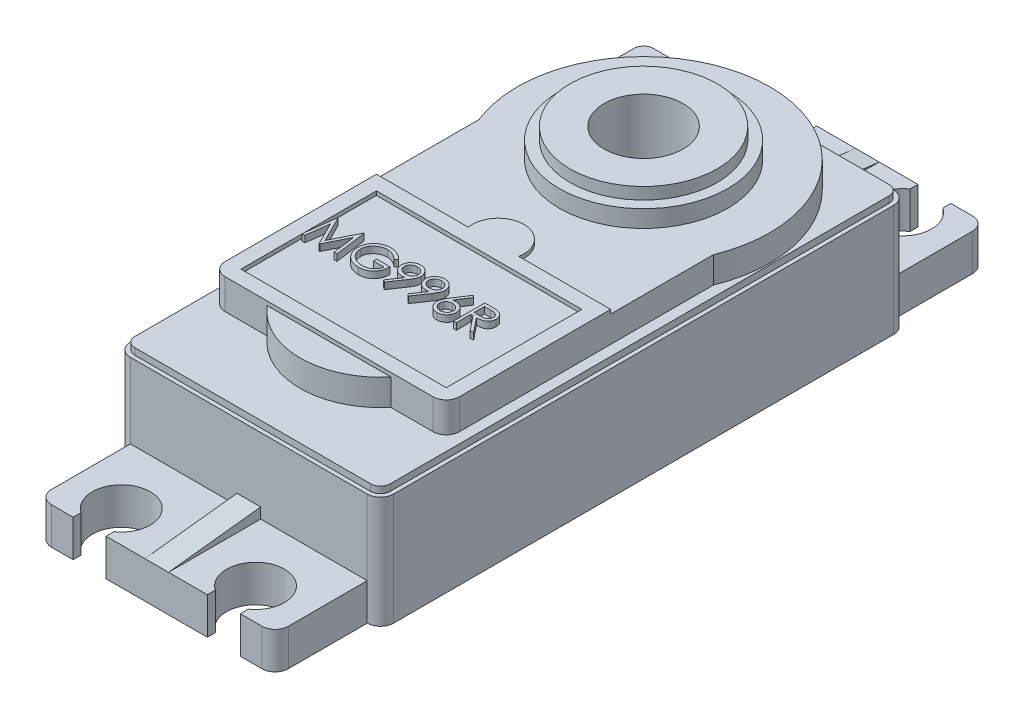
from build123d import *

# Parameters (mm, degrees)
BASES_W                              = 20
BASES_H                              = 40
BASE_DEPTH                           = 9
SHAFTHOLES_R                         = 3
SHAFT_HOLE_DEPTH                     = 25.103941586
MOUNTINGTABS_W                       = 18
MOUNTINGTABS_H                       = 2.8
MOUNTING_TAB_DEPTH                   = 7
MOUNTING_HOLE_DEPTH                  = 30.452334373
BOTTOMALIGNHOLES_R                   = 0.7
BOTTOM_ALIGN_HOLE_DEPTH              = 0.5
TRIANGULAR_TAB_DEPTH                 = 0.9
MOUNTING_TAB_FEATURES_M_COPY_1_DEPTH = 30.452334373
BASE_START                           = 2
BASETOPBODYS_R                       = 3
BASE_TOP_BODY_DEPTH                  = 2
PART_CIRCLE_DEPTH                    = 2
TOP_START                            = 1.3
TOPBODYCYLINDER1_R                   = 6.4
TOPBODYCYLINDER1_R_2                 = 3
TOP_BODY_CYLINDER_1_DEPTH            = 1.3
TOB_START                            = 0.9
TOPBODYCYLINDER2_R                   = 5.6
TOPBODYCYLINDER2_R_2                 = 3
TOB_BODY_CYLINDER_2_DEPTH            = 0.9
TOPBODYLABELNEST_W                   = 17.8
TOPBODYLABELNEST_H                   = 12.5
TOPBODYLABELNEST_W_2                 = 15.6
TOPBODYLABELNEST_H_2                 = 10.3
TOP_BODY_LABEL_NEST_DEPTH            = 0.3
PART_CIRCLE_2_DEPTH                  = 0.3
BORDERCUTS_W                         = 20
BORDERCUTS_H                         = 40
BORDERCUTS_W_2                       = 19.4
BORDERCUTS_H_2                       = 39.4
BORDER_CUT_DEPTH                     = 0.5
MAIN_BODY_FEATURES_F_R               = 1
BORDER_CUT_F_R                       = 0.75
BOSS_EXTRU_1_DEPTH                   = 0.5


with BuildPart() as part:
    # BaseS → BASE (new body)
    with BuildSketch(Plane(origin=(0, 0, 0), x_dir=(1, 0, 0), z_dir=(0, 1, 0))):
        Rectangle(BASES_W, BASES_H)
    extrude(amount=BASE_DEPTH)

    # ShaftHoleS → SHAFT HOLE (cut, through all)
    with BuildSketch(Plane(origin=(0, 9, 0), x_dir=(1, 0, 0), z_dir=(0, 1, 0))):
        with Locations(Location((0, 10, 0), (0, 0, 270))):
            Circle(SHAFTHOLES_R)
    extrude(amount=-SHAFT_HOLE_DEPTH, mode=Mode.SUBTRACT)

    # MountingTabS → MOUNTING TAB (add)
    with BuildSketch(Plane.XY.offset(20)):
        with Locations((0, 1.4)):
            Rectangle(MOUNTINGTABS_W, MOUNTINGTABS_H)
    mounting_tab = extrude(amount=MOUNTING_TAB_DEPTH)

    # MountingHoleS → MOUNTING HOLE (cut, through all)
    with BuildSketch(Plane(origin=(0, 2.8, 0), x_dir=(1, 0, 0), z_dir=(0, 1, 0))):
        with BuildLine():
            Line((-6.35, -26.4), (-6.35, -27))
            Line((-6.35, -27), (-3.85, -27))
            Line((-3.85, -27), (-3.85, -26.4))
            ThreePointArc((-3.85, -26.4), (-5.1, -22.389613301), (-6.35, -26.4))
        make_face()
    mounting_hole = extrude(amount=-MOUNTING_HOLE_DEPTH, mode=Mode.SUBTRACT)

    # MH M: MOUNTING HOLE across plane
    add(mounting_hole.mirror(Plane(origin=(0, 0, 0), x_dir=(0, 0, 1), z_dir=(1, 0, 0))), mode=Mode.SUBTRACT)

    # BottomAlignHoleS → BOTTOM ALIGN HOLE (cut)
    with BuildSketch(Plane.XZ):
        with Locations(Location((0, 25, 0), (0, 0, 270))):
            Circle(BOTTOMALIGNHOLES_R)
    bottom_align_hole = extrude(amount=-BOTTOM_ALIGN_HOLE_DEPTH, mode=Mode.SUBTRACT)

    # TriangularTabS → TRIANGULAR TAB (add, symmetric)
    with BuildSketch(Plane(origin=(0, 0, 0), x_dir=(0, 0, -1), z_dir=(1, 0, 0))):
        Polygon((-20, 2.8), (-27, 2.8), (-20, 3.6), align=None)
    triangular_tab = extrude(amount=TRIANGULAR_TAB_DEPTH, both=True)

    # MOUNTING TAB FEATURES M: MOUNTING TAB, MOUNTING HOLE, BOTTOM ALIGN HOLE, TRIANGULAR TAB across plane
    add(mounting_tab.mirror(Plane.XY))
    add(mounting_hole.mirror(Plane.XY), mode=Mode.SUBTRACT)
    add(bottom_align_hole.mirror(Plane.XY), mode=Mode.SUBTRACT)
    add(triangular_tab.mirror(Plane.XY))

    # MOUNTING TAB FEATURES M copy 1 sketch → MOUNTING TAB FEATURES M copy 1 (cut, through all)
    with BuildSketch(Plane(origin=(0, 2.8, 0), x_dir=(-1, 0, 0), z_dir=(0, 1, 0))):
        with BuildLine():
            Line((-6.35, -26.4), (-6.35, -27))
            Line((-6.35, -27), (-3.85, -27))
            Line((-3.85, -27), (-3.85, -26.4))
            ThreePointArc((-3.85, -26.4), (-5.1, -22.389613301), (-6.35, -26.4))
        make_face()
    extrude(amount=-MOUNTING_TAB_FEATURES_M_COPY_1_DEPTH, mode=Mode.SUBTRACT)

    # BaseTopBodyS → BASE TOP BODY (add)
    with BuildSketch(Plane(origin=(0, 9, 0), x_dir=(1, 0, 0), z_dir=(0, 1, 0)).offset(BASE_START)):
        with BuildLine():
            Line((-8.9, -13.898610843), (8.9, -13.898610843))
            Line((8.9, -13.898610843), (8.9, 6.401389157))
            ThreePointArc((8.9, 6.401389157), (0, 19.6), (-8.9, 6.401389157))
            Line((-8.9, 6.401389157), (-8.9, -13.898610843))
        make_face()
        with Locations(Location((0, 10, 0), (0, 0, 270))):
            Circle(BASETOPBODYS_R, mode=Mode.SUBTRACT)
    extrude(amount=-BASE_TOP_BODY_DEPTH)

    # PartCircleS → PART CIRCLE (add)
    with BuildSketch(Plane(origin=(0, 9, 0), x_dir=(1, 0, 0), z_dir=(0, 1, 0))):
        with BuildLine():
            Line((-4.7, -13.898610843), (4.7, -13.898610843))
            ThreePointArc((4.7, -13.898610843), (0, -16.098610843), (-4.7, -13.898610843))
        make_face()
    extrude(amount=PART_CIRCLE_DEPTH)

    # TopBodyCylinder1 → TOP BODY CYLINDER 1 (add)
    with BuildSketch(Plane(origin=(0, 11, 0), x_dir=(1, 0, 0), z_dir=(0, 1, 0)).offset(TOP_START)):
        with Locations(Location((0, 10, 0), (0, 0, 270))):
            Circle(TOPBODYCYLINDER1_R)
        with Locations(Location((0, 10, 0), (0, 0, 270))):
            Circle(TOPBODYCYLINDER1_R_2, mode=Mode.SUBTRACT)
    extrude(amount=-TOP_BODY_CYLINDER_1_DEPTH)

    # TopBodyCylinder2 → TOB BODY CYLINDER 2 (add)
    with BuildSketch(Plane(origin=(0, 12.3, 0), x_dir=(1, 0, 0), z_dir=(0, 1, 0)).offset(TOB_START)):
        with Locations(Location((0, 10, 0), (0, 0, 270))):
            Circle(TOPBODYCYLINDER2_R)
        with Locations(Location((0, 10, 0), (0, 0, 270))):
            Circle(TOPBODYCYLINDER2_R_2, mode=Mode.SUBTRACT)
    extrude(amount=-TOB_BODY_CYLINDER_2_DEPTH)

    # TopBodyLabelNest → TOP BODY LABEL NEST (add)
    with BuildSketch(Plane(origin=(0, 11, 0), x_dir=(1, 0, 0), z_dir=(0, 1, 0))):
        with Locations((0, -7.648610843)):
            Rectangle(TOPBODYLABELNEST_W, TOPBODYLABELNEST_H)
        with Locations((0, -7.648610843)):
            Rectangle(TOPBODYLABELNEST_W_2, TOPBODYLABELNEST_H_2, mode=Mode.SUBTRACT)
    extrude(amount=TOP_BODY_LABEL_NEST_DEPTH)

    # PartCircle2S → PART CIRCLE 2 (add)
    with BuildSketch(Plane(origin=(0, 11, 0), x_dir=(1, 0, 0), z_dir=(0, 1, 0))):
        with BuildLine():
            Line((1.303840481, -2.498610843), (-1.303840481, -2.498610843))
            ThreePointArc((-1.303840481, -2.498610843), (0, 0.901389157), (1.303840481, -2.498610843))
        make_face()
    extrude(amount=PART_CIRCLE_2_DEPTH)

    # BorderCutS → BORDER CUT (cut)
    with BuildSketch(Plane(origin=(0, 9, 0), x_dir=(1, 0, 0), z_dir=(0, 1, 0))):
        Rectangle(BORDERCUTS_W, BORDERCUTS_H)
        Rectangle(BORDERCUTS_W_2, BORDERCUTS_H_2, mode=Mode.SUBTRACT)
    extrude(amount=-BORDER_CUT_DEPTH, mode=Mode.SUBTRACT)

    # MAIN BODY FEATURES F
    main_body_features_f_edges = [part.edges().sort_by_distance(p)[0] for p in [
        (9, 1.4, -27),
        (-9, 1.4, -27),
        (-10, 4.25, -20),
        (10, 4.25, -20),
        (-8.9, 10.15, 13.898610843),
        (8.9, 10.15, 13.898610843),
        (-10, 4.25, 20),
        (10, 4.25, 20),
        (9, 1.4, 27),
        (-9, 1.4, 27),
    ]]
    fillet(main_body_features_f_edges, radius=MAIN_BODY_FEATURES_F_R)

    # BORDER CUT F
    border_cut_f_edges = [part.edges().sort_by_distance(p)[0] for p in [
        (9.7, 8.75, -19.7),
        (9.7, 8.75, 19.7),
        (-9.7, 8.75, 19.7),
        (-9.7, 8.75, -19.7),
    ]]
    fillet(border_cut_f_edges, radius=BORDER_CUT_F_R)

    # Esquisse1 → Boss.-Extru.1 (add)
    # profile 1 of 6: a face of its own
    with BuildSketch(Plane(origin=(0, 11, 0), x_dir=(1, 0, 0), z_dir=(0, 1, 0))):
        Polygon((-7.616826923, -8.339693128), (-7.30247521, -5.958443128), (-7.271946364, -5.958443128), (-6.288822115, -7.912289282), (-5.308082933, -5.958443128), (-5.277077073, -5.958443128), (-4.960817308, -8.339693128), (-5.175473257, -8.339693128), (-5.403485577, -6.626261638), (-6.263063401, -8.339693128), (-6.311241737, -8.339693128), (-7.174158654, -6.622445532), (-7.40169396, -8.339693128), align=None)
    # profile 2 of 6: a face of its own
    with BuildSketch(Plane(origin=(0, 11, 0), x_dir=(1, 0, 0), z_dir=(0, 1, 0))):
        with BuildLine():
            Line((-2.24375, -6.364858393), (-2.426923077, -6.538491205))
            add(Edge.make_bspline(
                [(-2.426923077, -6.538491205), (-2.46006932, -6.50730985), (-2.525571416, -6.445690677), (-2.632360439, -6.365741232), (-2.743778197, -6.297252332), (-2.859243306, -6.241526839), (-2.975896358, -6.197063622), (-3.092188972, -6.165407869), (-3.206928279, -6.145219946), (-3.283242048, -6.142805788), (-3.320845853, -6.141616205)],
                knots=[0, 0, 0, 0, 1.08915593, 2.152340314, 3.188132944, 4.216796309, 5.218260357, 6.173443236, 7.099959455, 8, 8, 8, 8], degree=3))
            add(Edge.make_bspline(
                [(-3.320845853, -6.141616205), (-3.343919962, -6.141897605), (-3.390008335, -6.142459674), (-3.458467193, -6.149633507), (-3.526208066, -6.15995103), (-3.593103076, -6.174879343), (-3.659282291, -6.193799436), (-3.72451554, -6.217465974), (-3.788924512, -6.245058024), (-3.851902507, -6.276941243), (-3.912958099, -6.311965924), (-3.970623018, -6.350779306), (-4.025264812, -6.392137394), (-4.075856459, -6.437075649), (-4.12268897, -6.485187013), (-4.166877058, -6.535576512), (-4.206866612, -6.589620831), (-4.242987565, -6.646325623), (-4.27521038, -6.704694951), (-4.303655196, -6.764167003), (-4.327533751, -6.824544519), (-4.346426898, -6.885903261), (-4.362014325, -6.947768537), (-4.372980054, -7.010568713), (-4.379162271, -7.074371031), (-4.380231642, -7.117095594), (-4.380769231, -7.138573837)],
                knots=[0, 0, 0, 0, 1.02818874, 2.053710826, 3.065248034, 4.081641283, 5.106893873, 6.131558223, 7.173050175, 8.228653731, 9.27666206, 10.308777013, 11.325269123, 12.329503258, 13.32196095, 14.316845687, 15.314881793, 16.315733098, 17.311955233, 18.285320748, 19.252783886, 20.203351036, 21.145449891, 22.095197417, 23.042428769, 24, 24, 24, 24], degree=3))
            add(Edge.make_bspline(
                [(-4.380769231, -7.138573837), (-4.380255072, -7.160529518), (-4.37922816, -7.204380927), (-4.372655692, -7.269827251), (-4.360458086, -7.334301569), (-4.344151484, -7.398015746), (-4.323753822, -7.461078898), (-4.298327062, -7.523217624), (-4.268210644, -7.584429622), (-4.23335149, -7.644163358), (-4.195124805, -7.702349558), (-4.15230103, -7.757158804), (-4.106811955, -7.809320954), (-4.057000355, -7.857677857), (-4.004463488, -7.903522973), (-3.947631707, -7.945593212), (-3.887622533, -7.984698931), (-3.824344412, -8.020347278), (-3.758483948, -8.052193799), (-3.690953907, -8.080512914), (-3.621538554, -8.103835106), (-3.550602688, -8.122842995), (-3.478230873, -8.138423376), (-3.40405575, -8.148446724), (-3.328622711, -8.155720307), (-3.277773749, -8.156252122), (-3.25215595, -8.156520051)],
                knots=[0, 0, 0, 0, 0.93586088, 1.869166235, 2.799637598, 3.729985548, 4.670839027, 5.622275134, 6.589130586, 7.576015415, 8.568469353, 9.55398029, 10.53834874, 11.515998671, 12.510579167, 13.508179873, 14.527009472, 15.561807829, 16.601455013, 17.643573243, 18.680854198, 19.719860599, 20.772568776, 21.833555941, 22.908541556, 24, 24, 24, 24], degree=3))
            add(Edge.make_bspline(
                [(-3.25215595, -8.156520051), (-3.221282467, -8.155874681), (-3.160657368, -8.15460739), (-3.071539806, -8.144742015), (-2.985948788, -8.129334107), (-2.904124818, -8.106769452), (-2.825972859, -8.077987845), (-2.751206411, -8.043292769), (-2.680414122, -8.001353474), (-2.613383177, -7.954018396), (-2.551635878, -7.901280627), (-2.49594584, -7.844372524), (-2.447201319, -7.783570322), (-2.404675801, -7.719232134), (-2.369495449, -7.650825417), (-2.34061919, -7.578685406), (-2.318484932, -7.502779652), (-2.30939878, -7.45032981), (-2.304807692, -7.423827743)],
                knots=[0, 0, 0, 0, 1.13008108, 2.219097802, 3.278683437, 4.311054135, 5.322181354, 6.324827112, 7.324222904, 8.330512327, 9.32562643, 10.293043162, 11.24128371, 12.174520618, 13.111833804, 14.052305215, 15.015860969, 16, 16, 16, 16], degree=3))
            Line((-2.304807692, -7.423827743), (-3.098557692, -7.423827743))
            Line((-3.098557692, -7.423827743), (-3.098557692, -7.179596974))
            Line((-3.098557692, -7.179596974), (-2.091105769, -7.179596974))
            add(Edge.make_bspline(
                [(-2.091105769, -7.179596974), (-2.092266355, -7.225117962), (-2.094537832, -7.314210758), (-2.110471059, -7.444138746), (-2.136199793, -7.566855916), (-2.171347255, -7.682491506), (-2.21684633, -7.790881647), (-2.272208711, -7.892136388), (-2.338320457, -7.985601594), (-2.412826668, -8.072040291), (-2.496442533, -8.14914463), (-2.586908683, -8.216912241), (-2.684374585, -8.273995985), (-2.788748043, -8.320437614), (-2.899687373, -8.356682957), (-3.017449289, -8.382381119), (-3.141874092, -8.397777576), (-3.227147796, -8.399744747), (-3.270759465, -8.40075082)],
                knots=[0, 0, 0, 0, 1.140356446, 2.231883559, 3.274166699, 4.278491846, 5.25512956, 6.21435461, 7.1637429, 8.11826594, 9.068280886, 10.0076534, 10.945064095, 11.891975133, 12.864533718, 13.863980011, 14.907571808, 16, 16, 16, 16], degree=3))
            add(Edge.make_bspline(
                [(-3.270759465, -8.40075082), (-3.297640468, -8.400363615), (-3.350658469, -8.39959992), (-3.428961404, -8.394172475), (-3.505105357, -8.385817297), (-3.579079234, -8.37319999), (-3.651155142, -8.357745913), (-3.72097311, -8.337956556), (-3.788799098, -8.315049816), (-3.854737942, -8.288995081), (-3.918191143, -8.258806507), (-3.979441327, -8.225258342), (-4.038827066, -8.188523573), (-4.09594384, -8.147966908), (-4.151089251, -8.103891699), (-4.203907719, -8.056209604), (-4.254694936, -8.005066396), (-4.286508751, -7.968749605), (-4.302539063, -7.95045034)],
                knots=[0, 0, 0, 0, 1.107784379, 2.184907829, 3.233506516, 4.263428166, 5.276301166, 6.270063455, 7.25232949, 8.225834625, 9.190232166, 10.146266622, 11.1027726, 12.066435141, 13.031522626, 14.010570082, 14.99756817, 16, 16, 16, 16], degree=3))
            add(Edge.make_bspline(
                [(-4.302539063, -7.95045034), (-4.325797705, -7.921419056), (-4.371928922, -7.863838378), (-4.431309239, -7.771581988), (-4.481928765, -7.676058579), (-4.523000444, -7.577002234), (-4.555071178, -7.474505605), (-4.578071503, -7.368699666), (-4.591547534, -7.259448167), (-4.593488959, -7.185516978), (-4.594471154, -7.148114102)],
                knots=[0, 0, 0, 0, 1.023165419, 2.029347347, 3.013907458, 3.994755782, 4.975994455, 5.96558838, 6.970761222, 8, 8, 8, 8], degree=3))
            add(Edge.make_bspline(
                [(-4.594471154, -7.148114102), (-4.594109042, -7.120106348), (-4.59338942, -7.064446801), (-4.584663488, -6.981812454), (-4.572143952, -6.900645376), (-4.553742296, -6.821011916), (-4.530544658, -6.742858888), (-4.50159309, -6.666150005), (-4.467884866, -6.59084), (-4.428706163, -6.517447243), (-4.385105843, -6.446945634), (-4.337786854, -6.379618986), (-4.286077261, -6.31669339), (-4.230821512, -6.257371929), (-4.171360345, -6.202399856), (-4.108250809, -6.15126822), (-4.041444267, -6.103908433), (-3.970730544, -6.061066456), (-3.897165102, -6.022582993), (-3.82092428, -5.988844619), (-3.74203135, -5.960961327), (-3.66107737, -5.937302738), (-3.577449571, -5.919807258), (-3.491754821, -5.907119451), (-3.403546442, -5.898437686), (-3.343922643, -5.897739465), (-3.313690655, -5.897385436)],
                knots=[0, 0, 0, 0, 1.008945113, 2.00506715, 2.99143336, 3.967273523, 4.948097931, 5.927297278, 6.919902385, 7.919676788, 8.923139349, 9.905703106, 10.883022732, 11.856032218, 12.825136022, 13.798837087, 14.781400844, 15.773989409, 16.776158564, 17.77167057, 18.775803737, 19.789618931, 20.80898985, 21.851988756, 22.910860228, 24, 24, 24, 24], degree=3))
            add(Edge.make_bspline(
                [(-3.313690655, -5.897385436), (-3.289035707, -5.897779697), (-3.240147843, -5.898561471), (-3.167400157, -5.903980276), (-3.095776909, -5.912569024), (-3.025171901, -5.924289391), (-2.95582557, -5.940253081), (-2.887540365, -5.959356342), (-2.8202173, -5.981598457), (-2.754067366, -6.008124797), (-2.688645778, -6.038233067), (-2.623588775, -6.072123985), (-2.559118645, -6.110377068), (-2.495123585, -6.153105902), (-2.431200046, -6.199576621), (-2.368359102, -6.251118317), (-2.305083884, -6.305698442), (-2.264397293, -6.344942927), (-2.24375, -6.364858393)],
                knots=[0, 0, 0, 0, 0.985871117, 1.954866573, 2.915460327, 3.869826059, 4.81536089, 5.759505086, 6.70452669, 7.649098992, 8.607881297, 9.583363685, 10.581137262, 11.603961102, 12.659522466, 13.73993555, 14.853081303, 16, 16, 16, 16], degree=3))
        make_face()
    # profile 3 of 6: a face of its own
    with BuildSketch(Plane(origin=(0, 11, 0), x_dir=(1, 0, 0), z_dir=(0, 1, 0))):
        with BuildLine():
            Line((-1.297355769, -8.40075082), (-1.468126502, -8.281974528))
            Line((-1.468126502, -8.281974528), (-0.806032151, -7.314114703))
            add(Edge.make_bspline(
                [(-0.806032151, -7.314114703), (-0.848276027, -7.319280697), (-0.931456573, -7.329452829), (-1.01523378, -7.331321536), (-1.056464093, -7.332241205)],
                knots=[0, 0, 0, 0, 1.015715272, 2, 2, 2, 2], degree=3))
            add(Edge.make_bspline(
                [(-1.056464093, -7.332241205), (-1.081461807, -7.331600937), (-1.130530135, -7.330344147), (-1.202669527, -7.320382488), (-1.271988096, -7.305040347), (-1.338302069, -7.282147176), (-1.401860696, -7.253695859), (-1.462525226, -7.21841457), (-1.520213994, -7.176908503), (-1.574307429, -7.129397129), (-1.623505237, -7.077228668), (-1.667336088, -7.022013847), (-1.703763179, -6.963111267), (-1.734023142, -6.901722492), (-1.756971897, -6.83696518), (-1.773683195, -6.769576213), (-1.783971796, -6.699083293), (-1.785195824, -6.651101016), (-1.785817308, -6.626738651)],
                knots=[0, 0, 0, 0, 1.060718605, 2.082097864, 3.085795603, 4.069760067, 5.054557537, 6.03741023, 7.043284206, 8.066802108, 9.088538119, 10.083643548, 11.053783639, 12.022749082, 12.983451788, 13.964007469, 14.966251758, 16, 16, 16, 16], degree=3))
            add(Edge.make_bspline(
                [(-1.785817308, -6.626738651), (-1.784637273, -6.593422478), (-1.782321103, -6.52802959), (-1.763680326, -6.432484472), (-1.733023203, -6.342142199), (-1.690277468, -6.257240299), (-1.636437595, -6.179000085), (-1.571729786, -6.108509228), (-1.496547625, -6.046770318), (-1.412603787, -5.993699687), (-1.321876106, -5.951017484), (-1.226851537, -5.919558245), (-1.128258181, -5.901053383), (-1.061469105, -5.898613717), (-1.027843299, -5.897385436)],
                knots=[0, 0, 0, 0, 1.022988612, 2.007919123, 2.978103895, 3.94594894, 4.918897164, 5.887013414, 6.875921846, 7.89917871, 8.930658928, 9.948724884, 10.967259574, 12, 12, 12, 12], degree=3))
            add(Edge.make_bspline(
                [(-1.027843299, -5.897385436), (-0.994853857, -5.8986306), (-0.929669827, -5.901090928), (-0.833814986, -5.919109486), (-0.742006901, -5.949478365), (-0.654754508, -5.991445898), (-0.573969301, -6.04405173), (-0.501323615, -6.106736111), (-0.438475257, -6.179538086), (-0.385527224, -6.260696862), (-0.343025286, -6.347896184), (-0.312360036, -6.438917031), (-0.293483092, -6.533104804), (-0.291104341, -6.596918544), (-0.289903846, -6.629123717)],
                knots=[0, 0, 0, 0, 1.026385292, 2.028040595, 3.023318987, 4.028184125, 5.03290303, 6.015178782, 7.004435299, 8.016004309, 9.023023918, 10.015172535, 10.998308025, 12, 12, 12, 12], degree=3))
            add(Edge.make_bspline(
                [(-0.289903846, -6.629123717), (-0.290705585, -6.654122601), (-0.292331712, -6.704826585), (-0.303718378, -6.781863658), (-0.323054254, -6.860411727), (-0.344996928, -6.926897312), (-0.36617792, -6.981807883), (-0.386113155, -7.025181725), (-0.40823303, -7.070834549), (-0.434031333, -7.118287649), (-0.461764253, -7.168145945), (-0.493101011, -7.219909364), (-0.527326766, -7.273647368), (-0.551703772, -7.309874405), (-0.564186448, -7.328425099)],
                knots=[0, 0, 0, 0, 1.179839688, 2.393009684, 3.667231171, 4.993948276, 5.694988576, 6.444077775, 7.246288328, 8.089075292, 8.993003841, 9.939041771, 10.944649915, 12, 12, 12, 12], degree=3))
            Line((-0.564186448, -7.328425099), (-1.297355769, -8.40075082))
        make_face()
        with BuildLine():
            add(Edge.make_bspline(
                [(-1.016871995, -7.088010436), (-0.997934925, -7.087493103), (-0.961070887, -7.086486033), (-0.907065974, -7.080356531), (-0.856090757, -7.069488515), (-0.808009068, -7.053894925), (-0.762338801, -7.035078513), (-0.719805371, -7.011121787), (-0.68037318, -6.982535469), (-0.64377818, -6.950415798), (-0.611281601, -6.914730669), (-0.582337147, -6.87738103), (-0.557735046, -6.838202929), (-0.538301817, -6.796705728), (-0.522323918, -6.753899555), (-0.511289878, -6.709095074), (-0.505177322, -6.662525716), (-0.504135304, -6.630890022), (-0.503605769, -6.61481332)],
                knots=[0, 0, 0, 0, 1.163407946, 2.26475976, 3.333800367, 4.359385343, 5.366239384, 6.363380779, 7.350133999, 8.353570782, 9.349036268, 10.310270964, 11.253520213, 12.184142, 13.120487599, 14.056272588, 15.012232024, 16, 16, 16, 16], degree=3))
            add(Edge.make_bspline(
                [(-0.503605769, -6.61481332), (-0.504061383, -6.598729905), (-0.504959227, -6.567035563), (-0.512162372, -6.520397258), (-0.524834176, -6.475702379), (-0.54183663, -6.432706236), (-0.564234149, -6.39176209), (-0.591110628, -6.352355892), (-0.623041456, -6.314737498), (-0.659782487, -6.279791645), (-0.699402781, -6.247578163), (-0.741626086, -6.219148708), (-0.786104377, -6.195321787), (-0.8325663, -6.175660166), (-0.881108658, -6.160316905), (-0.931702729, -6.149283305), (-0.984604174, -6.143179307), (-1.020514299, -6.142143876), (-1.038814603, -6.141616205)],
                knots=[0, 0, 0, 0, 0.972161553, 1.915763587, 2.844109794, 3.775983486, 4.705125789, 5.659731448, 6.655561913, 7.682237399, 8.721216875, 9.739758359, 10.754845918, 11.767244016, 12.7857855, 13.828538656, 14.893392813, 16, 16, 16, 16], degree=3))
            add(Edge.make_bspline(
                [(-1.038814603, -6.141616205), (-1.056955751, -6.142144728), (-1.092548532, -6.143181686), (-1.144979683, -6.149271702), (-1.195231656, -6.160391108), (-1.243633366, -6.175653059), (-1.290093908, -6.195323254), (-1.334570101, -6.219149956), (-1.376803282, -6.247571619), (-1.41638559, -6.279816991), (-1.453191498, -6.314574836), (-1.484573331, -6.352520687), (-1.511511319, -6.391741592), (-1.533878062, -6.432711684), (-1.550888703, -6.475700925), (-1.563558315, -6.520397652), (-1.570762048, -6.56703546), (-1.571659811, -6.598729871), (-1.572115385, -6.61481332)],
                knots=[0, 0, 0, 0, 1.099389452, 2.15699305, 3.192601482, 4.213358962, 5.227959689, 6.245255729, 7.266013209, 8.307253147, 9.336162325, 10.327954924, 11.284637477, 12.215801273, 13.149702402, 14.080068371, 15.025723358, 16, 16, 16, 16], degree=3))
            add(Edge.make_bspline(
                [(-1.572115385, -6.61481332), (-1.571703138, -6.630902541), (-1.570890114, -6.66263343), (-1.5630471, -6.709255851), (-1.549930984, -6.753947283), (-1.532364577, -6.797142278), (-1.509231353, -6.83842081), (-1.480844235, -6.877587176), (-1.447570997, -6.915085366), (-1.409856428, -6.950332773), (-1.368580411, -6.982685235), (-1.324495482, -7.010940727), (-1.278360575, -7.034802515), (-1.230013287, -7.053948707), (-1.179811911, -7.069332713), (-1.127305259, -7.080336501), (-1.072666976, -7.086427239), (-1.035648756, -7.08747764), (-1.016871995, -7.088010436)],
                knots=[0, 0, 0, 0, 0.952633368, 1.87876736, 2.791047057, 3.707742249, 4.635551637, 5.587206343, 6.568248508, 7.601284464, 8.641511608, 9.671105535, 10.699146789, 11.713763218, 12.747829548, 13.806491675, 14.887386225, 16, 16, 16, 16], degree=3))
        make_face(mode=Mode.SUBTRACT)
    # profile 4 of 6: a face of its own
    with BuildSketch(Plane(origin=(0, 11, 0), x_dir=(1, 0, 0), z_dir=(0, 1, 0))):
        with BuildLine():
            Line((0.534375, -8.40075082), (0.363604267, -8.281974528))
            Line((0.363604267, -8.281974528), (1.025698618, -7.314114703))
            add(Edge.make_bspline(
                [(1.025698618, -7.314114703), (0.983454742, -7.319280697), (0.900274196, -7.329452829), (0.816496989, -7.331321536), (0.775266677, -7.332241205)],
                knots=[0, 0, 0, 0, 1.015715272, 2, 2, 2, 2], degree=3))
            add(Edge.make_bspline(
                [(0.775266677, -7.332241205), (0.750268962, -7.331600937), (0.701200634, -7.330344147), (0.629061242, -7.320382488), (0.559742673, -7.305040347), (0.493428701, -7.282147176), (0.429870073, -7.253695859), (0.369205543, -7.21841457), (0.311516775, -7.176908503), (0.257423341, -7.129397129), (0.208225532, -7.077228668), (0.164394682, -7.022013847), (0.12796759, -6.963111267), (0.097707628, -6.901722492), (0.074758872, -6.83696518), (0.058047575, -6.769576213), (0.047758973, -6.699083293), (0.046534945, -6.651101016), (0.045913462, -6.626738651)],
                knots=[0, 0, 0, 0, 1.060718605, 2.082097864, 3.085795603, 4.069760067, 5.054557537, 6.03741023, 7.043284206, 8.066802108, 9.088538119, 10.083643548, 11.053783639, 12.022749082, 12.983451788, 13.964007469, 14.966251758, 16, 16, 16, 16], degree=3))
            add(Edge.make_bspline(
                [(0.045913462, -6.626738651), (0.047093497, -6.593422478), (0.049409666, -6.52802959), (0.068050443, -6.432484472), (0.098707567, -6.342142199), (0.141453302, -6.257240299), (0.195293175, -6.179000085), (0.260000983, -6.108509228), (0.335183145, -6.046770318), (0.419126983, -5.993699687), (0.509854663, -5.951017484), (0.604879232, -5.919558245), (0.703472589, -5.901053383), (0.770261664, -5.898613717), (0.80388747, -5.897385436)],
                knots=[0, 0, 0, 0, 1.022988612, 2.007919123, 2.978103895, 3.94594894, 4.918897164, 5.887013414, 6.875921846, 7.89917871, 8.930658928, 9.948724884, 10.967259574, 12, 12, 12, 12], degree=3))
            add(Edge.make_bspline(
                [(0.80388747, -5.897385436), (0.836876913, -5.8986306), (0.902060942, -5.901090928), (0.997915784, -5.919109486), (1.089723868, -5.949478365), (1.176976261, -5.991445898), (1.257761468, -6.04405173), (1.330407154, -6.106736111), (1.393255512, -6.179538086), (1.446203545, -6.260696862), (1.488705483, -6.347896184), (1.519370733, -6.438917031), (1.538247677, -6.533104804), (1.540626428, -6.596918544), (1.541826923, -6.629123717)],
                knots=[0, 0, 0, 0, 1.026385292, 2.028040595, 3.023318987, 4.028184125, 5.03290303, 6.015178782, 7.004435299, 8.016004309, 9.023023918, 10.015172535, 10.998308025, 12, 12, 12, 12], degree=3))
            add(Edge.make_bspline(
                [(1.541826923, -6.629123717), (1.541025184, -6.654122601), (1.539399057, -6.704826585), (1.528012391, -6.781863658), (1.508676515, -6.860411727), (1.486733842, -6.926897312), (1.465552849, -6.981807883), (1.445617615, -7.025181725), (1.423497739, -7.070834549), (1.397699436, -7.118287649), (1.369966516, -7.168145945), (1.338629758, -7.219909364), (1.304404003, -7.273647368), (1.280026998, -7.309874405), (1.267544321, -7.328425099)],
                knots=[0, 0, 0, 0, 1.179839688, 2.393009684, 3.667231171, 4.993948276, 5.694988576, 6.444077775, 7.246288328, 8.089075292, 8.993003841, 9.939041771, 10.944649915, 12, 12, 12, 12], degree=3))
            Line((1.267544321, -7.328425099), (0.534375, -8.40075082))
        make_face()
        with BuildLine():
            add(Edge.make_bspline(
                [(0.814858774, -7.088010436), (0.833795844, -7.087493103), (0.870659882, -7.086486033), (0.924664795, -7.080356531), (0.975640012, -7.069488515), (1.023721701, -7.053894925), (1.069391968, -7.035078513), (1.111925399, -7.011121787), (1.151357589, -6.982535469), (1.18795259, -6.950415798), (1.220449168, -6.914730669), (1.249393623, -6.87738103), (1.273995723, -6.838202929), (1.293428953, -6.796705728), (1.309406851, -6.753899555), (1.320440892, -6.709095074), (1.326553447, -6.662525716), (1.327595465, -6.630890022), (1.328125, -6.61481332)],
                knots=[0, 0, 0, 0, 1.163407946, 2.26475976, 3.333800367, 4.359385343, 5.366239384, 6.363380779, 7.350133999, 8.353570782, 9.349036268, 10.310270964, 11.253520213, 12.184142, 13.120487599, 14.056272588, 15.012232024, 16, 16, 16, 16], degree=3))
            add(Edge.make_bspline(
                [(1.328125, -6.61481332), (1.327669386, -6.598729905), (1.326771542, -6.567035563), (1.319568397, -6.520397258), (1.306896594, -6.475702379), (1.289894139, -6.432706236), (1.26749662, -6.39176209), (1.240620141, -6.352355892), (1.208689314, -6.314737498), (1.171948282, -6.279791645), (1.132327988, -6.247578163), (1.090104683, -6.219148708), (1.045626392, -6.195321787), (0.99916447, -6.175660166), (0.950622111, -6.160316905), (0.90002804, -6.149283305), (0.847126595, -6.143179307), (0.81121647, -6.142143876), (0.792916166, -6.141616205)],
                knots=[0, 0, 0, 0, 0.972161553, 1.915763587, 2.844109794, 3.775983486, 4.705125789, 5.659731448, 6.655561913, 7.682237399, 8.721216875, 9.739758359, 10.754845918, 11.767244016, 12.7857855, 13.828538656, 14.893392813, 16, 16, 16, 16], degree=3))
            add(Edge.make_bspline(
                [(0.792916166, -6.141616205), (0.774775019, -6.142144728), (0.739182237, -6.143181686), (0.686751086, -6.149271702), (0.636499113, -6.160391108), (0.588097403, -6.175653059), (0.541636861, -6.195323254), (0.497160668, -6.219149956), (0.454927487, -6.247571619), (0.415345179, -6.279816991), (0.378539271, -6.314574836), (0.347157438, -6.352520687), (0.320219451, -6.391741592), (0.297852708, -6.432711684), (0.280842066, -6.475700925), (0.268172455, -6.520397652), (0.260968721, -6.56703546), (0.260070958, -6.598729871), (0.259615385, -6.61481332)],
                knots=[0, 0, 0, 0, 1.099389452, 2.15699305, 3.192601482, 4.213358962, 5.227959689, 6.245255729, 7.266013209, 8.307253147, 9.336162325, 10.327954924, 11.284637477, 12.215801273, 13.149702402, 14.080068371, 15.025723358, 16, 16, 16, 16], degree=3))
            add(Edge.make_bspline(
                [(0.259615385, -6.61481332), (0.260027631, -6.630902541), (0.260840656, -6.66263343), (0.26868367, -6.709255851), (0.281799785, -6.753947283), (0.299366192, -6.797142278), (0.322499417, -6.83842081), (0.350886535, -6.877587176), (0.384159772, -6.915085366), (0.421874341, -6.950332773), (0.463150358, -6.982685235), (0.507235287, -7.010940727), (0.553370194, -7.034802515), (0.601717482, -7.053948707), (0.651918859, -7.069332713), (0.70442551, -7.080336501), (0.759063793, -7.086427239), (0.796082013, -7.08747764), (0.814858774, -7.088010436)],
                knots=[0, 0, 0, 0, 0.952633368, 1.87876736, 2.791047057, 3.707742249, 4.635551637, 5.587206343, 6.568248508, 7.601284464, 8.641511608, 9.671105535, 10.699146789, 11.713763218, 12.747829548, 13.806491675, 14.887386225, 16, 16, 16, 16], degree=3))
        make_face(mode=Mode.SUBTRACT)
    # profile 5 of 6: a face of its own
    with BuildSketch(Plane(origin=(0, 11, 0), x_dir=(1, 0, 0), z_dir=(0, 1, 0))):
        with BuildLine():
            Line((2.946153846, -5.897385436), (3.110723407, -6.026656019))
            Line((3.110723407, -6.026656019), (2.481542969, -6.988791686))
            add(Edge.make_bspline(
                [(2.481542969, -6.988791686), (2.523432746, -6.982114756), (2.605143494, -6.969090648), (2.687851722, -6.966942118), (2.728158804, -6.965895051)],
                knots=[0, 0, 0, 0, 1.025318673, 2, 2, 2, 2], degree=3))
            add(Edge.make_bspline(
                [(2.728158804, -6.965895051), (2.752360806, -6.966545549), (2.800001727, -6.967826033), (2.869947069, -6.977680225), (2.937158827, -6.993209453), (3.001358424, -7.01584647), (3.062776292, -7.04476325), (3.121764887, -7.079419874), (3.177215361, -7.121605882), (3.229841789, -7.168730789), (3.277621296, -7.220925738), (3.319923219, -7.276307718), (3.35545609, -7.334819032), (3.38428549, -7.396430043), (3.40667256, -7.461045778), (3.422992725, -7.528583566), (3.432639913, -7.599089978), (3.433949934, -7.647040308), (3.434615385, -7.671397605)],
                knots=[0, 0, 0, 0, 1.04369286, 2.054478336, 3.041073146, 4.015093852, 4.984733326, 5.965804835, 6.960378782, 7.985147595, 9.009457201, 10.008161701, 10.986880575, 11.956520048, 12.937015923, 13.931873656, 14.949455224, 16, 16, 16, 16], degree=3))
            add(Edge.make_bspline(
                [(3.434615385, -7.671397605), (3.433647165, -7.704721297), (3.431741938, -7.770294435), (3.412757391, -7.86580073), (3.383257347, -7.956786602), (3.341090493, -8.041799385), (3.288714979, -8.120722562), (3.224844688, -8.190653387), (3.151744743, -8.253021752), (3.069090332, -8.30517563), (2.980138423, -8.347768063), (2.88669001, -8.378360487), (2.789652613, -8.397195133), (2.723790906, -8.399556382), (2.69047476, -8.40075082)],
                knots=[0, 0, 0, 0, 1.031375318, 2.029502543, 3.004789286, 3.987476834, 4.960371455, 5.9300674, 6.912260825, 7.929083631, 8.949397511, 9.960523116, 10.96833055, 12, 12, 12, 12], degree=3))
            add(Edge.make_bspline(
                [(2.69047476, -8.40075082), (2.658432183, -8.399711095), (2.594961449, -8.39765158), (2.501594137, -8.379305112), (2.411880191, -8.349568672), (2.326448166, -8.308601458), (2.247308606, -8.256854934), (2.176506807, -8.194559883), (2.114395796, -8.123047908), (2.06270592, -8.0423301), (2.021708461, -7.955591397), (1.990963173, -7.865146653), (1.9730043, -7.771325415), (1.970494764, -7.707724855), (1.969230769, -7.675690724)],
                knots=[0, 0, 0, 0, 1.012016664, 2.004627821, 2.994792927, 3.992885782, 4.990978636, 5.973936114, 6.964471063, 7.975201453, 8.993600317, 9.990122807, 10.98767138, 12, 12, 12, 12], degree=3))
            add(Edge.make_bspline(
                [(1.969230769, -7.675690724), (1.970034574, -7.651167535), (1.971675789, -7.601095867), (1.98313531, -7.525260519), (2.001549036, -7.447665051), (2.022170829, -7.381837645), (2.043959682, -7.327911502), (2.062092927, -7.284434306), (2.084663092, -7.23969329), (2.108729625, -7.192154262), (2.136458852, -7.143042388), (2.166609321, -7.091536855), (2.200014619, -7.038456801), (2.223432622, -7.00243584), (2.235404147, -6.984021554)],
                knots=[0, 0, 0, 0, 1.173818275, 2.396712641, 3.66331629, 4.989737886, 5.693666774, 6.447286557, 7.243889047, 8.091586357, 8.998013824, 9.943181721, 10.948533338, 12, 12, 12, 12], degree=3))
            Line((2.235404147, -6.984021554), (2.946153846, -5.897385436))
        make_face()
        with BuildLine():
            add(Edge.make_bspline(
                [(2.683319561, -7.21012582), (2.665179713, -7.210655168), (2.629747319, -7.211689138), (2.577762988, -7.217693461), (2.528564151, -7.229000361), (2.481498994, -7.243401026), (2.437447432, -7.2632015), (2.39608931, -7.287253349), (2.357264695, -7.315570615), (2.321380243, -7.347752128), (2.288845793, -7.382986486), (2.260827917, -7.420725572), (2.236659998, -7.460059878), (2.217010046, -7.501318056), (2.201708763, -7.544484335), (2.190640542, -7.589360182), (2.184480758, -7.636246522), (2.183455982, -7.668041314), (2.182932692, -7.684276962)],
                knots=[0, 0, 0, 0, 1.129588631, 2.206414736, 3.251139165, 4.268635594, 5.265702196, 6.250456724, 7.242448911, 8.251968645, 9.246821453, 10.222880186, 11.173611482, 12.116736599, 13.062300278, 14.020270554, 14.989073742, 16, 16, 16, 16], degree=3))
            add(Edge.make_bspline(
                [(2.182932692, -7.684276962), (2.183358842, -7.700367395), (2.184194458, -7.731918338), (2.191782018, -7.778413387), (2.203371958, -7.823157012), (2.220612477, -7.865918546), (2.241177557, -7.907349791), (2.268327429, -7.945950048), (2.298410635, -7.984063703), (2.334370186, -8.018762918), (2.372962331, -8.051050372), (2.414192792, -8.079271758), (2.457164122, -8.10341503), (2.502456465, -8.122336509), (2.549427222, -8.137865175), (2.598467742, -8.148792718), (2.649612131, -8.154970718), (2.684257236, -8.155996829), (2.701923077, -8.156520051)],
                knots=[0, 0, 0, 0, 0.989467248, 1.94019797, 2.891935182, 3.827694429, 4.772920941, 5.730924762, 6.725747692, 7.756678648, 8.79901574, 9.819492441, 10.826891316, 11.826466727, 12.835195252, 13.867842842, 14.912794438, 16, 16, 16, 16], degree=3))
            add(Edge.make_bspline(
                [(2.701923077, -8.156520051), (2.719588889, -8.155996788), (2.754233937, -8.154970597), (2.805378737, -8.148793179), (2.854417736, -8.137863481), (2.901394022, -8.12234265), (2.94666596, -8.103392248), (2.989599708, -8.07942196), (3.03044025, -8.050876815), (3.069057729, -8.018818095), (3.104867605, -7.983866209), (3.135672325, -7.946290272), (3.161990739, -7.907037819), (3.183377213, -7.866081754), (3.200427841, -7.823131156), (3.212076554, -7.778420314), (3.219648445, -7.731916525), (3.220486214, -7.700366783), (3.220913462, -7.684276962)],
                knots=[0, 0, 0, 0, 1.087397944, 2.132534446, 3.165364764, 4.174271784, 5.174024072, 6.181601208, 7.194203697, 8.236725232, 9.267838612, 10.269026844, 11.221737037, 12.171628256, 13.107553087, 14.05945871, 15.010357665, 16, 16, 16, 16], degree=3))
            add(Edge.make_bspline(
                [(3.220913462, -7.684276962), (3.220539066, -7.668020134), (3.219804249, -7.636113267), (3.211493041, -7.589381155), (3.199966176, -7.544256327), (3.182560578, -7.501022387), (3.159947857, -7.459849944), (3.132404682, -7.420531015), (3.100541809, -7.382764154), (3.063736161, -7.347683029), (3.02366977, -7.315606178), (2.981068809, -7.287290015), (2.936499991, -7.263392486), (2.890008505, -7.24345319), (2.841061651, -7.229063994), (2.790449653, -7.217733841), (2.737525186, -7.211704504), (2.701618243, -7.210658751), (2.683319561, -7.21012582)],
                knots=[0, 0, 0, 0, 0.978206639, 1.919901502, 2.851605144, 3.780102724, 4.718870031, 5.675451981, 6.667674623, 7.690630536, 8.733308323, 9.756129687, 10.767539656, 11.776269907, 12.797430371, 13.836405707, 14.897401972, 16, 16, 16, 16], degree=3))
        make_face(mode=Mode.SUBTRACT)
    # profile 6 of 6: a face of its own
    with BuildSketch(Plane(origin=(0, 11, 0), x_dir=(1, 0, 0), z_dir=(0, 1, 0))):
        with BuildLine():
            Line((3.892548077, -5.958443128), (4.369084285, -5.958443128))
            add(Edge.make_bspline(
                [(4.369084285, -5.958443128), (4.400884946, -5.958548982), (4.461945737, -5.958752234), (4.549421479, -5.959885547), (4.628905629, -5.963133814), (4.700356627, -5.965929118), (4.763773162, -5.971026314), (4.819349694, -5.975898112), (4.866830252, -5.982275549), (4.895572519, -5.988198345), (4.908586238, -5.990880027)],
                knots=[0, 0, 0, 0, 1.410062039, 2.707475311, 3.878576406, 4.937260626, 5.877586885, 6.699081471, 7.410979367, 8, 8, 8, 8], degree=3))
            add(Edge.make_bspline(
                [(4.908586238, -5.990880027), (4.926007888, -5.995184487), (4.960479536, -6.003701581), (5.010111634, -6.02170356), (5.057406201, -6.04253584), (5.102166778, -6.067004014), (5.144169165, -6.095289712), (5.183846444, -6.126904631), (5.221378661, -6.161675784), (5.255247949, -6.200479846), (5.287183268, -6.241190042), (5.314117673, -6.285211706), (5.337335867, -6.331245709), (5.355821522, -6.37976022), (5.370706358, -6.430284747), (5.38120171, -6.483276946), (5.387495821, -6.538495395), (5.388136619, -6.576158544), (5.388461538, -6.595255778)],
                knots=[0, 0, 0, 0, 1.027469482, 2.033020251, 3.019912614, 3.986113645, 4.951240523, 5.91722682, 6.890402269, 7.87763091, 8.8651537, 9.85103654, 10.82876324, 11.815024772, 12.821070561, 13.842952187, 14.906261191, 16, 16, 16, 16], degree=3))
            add(Edge.make_bspline(
                [(5.388461538, -6.595255778), (5.387462095, -6.626984305), (5.385511922, -6.688894878), (5.367329307, -6.778743442), (5.337545639, -6.862556172), (5.296504259, -6.940227538), (5.24423958, -7.010243531), (5.181425749, -7.071741323), (5.108027724, -7.123203478), (5.039699921, -7.158890118), (4.979342582, -7.181745293), (4.929653846, -7.197826459), (4.875451848, -7.210251117), (4.817255912, -7.22138185), (4.754823853, -7.229785413), (4.688305309, -7.235940329), (4.617652838, -7.239787101), (4.569116792, -7.240359965), (4.544148137, -7.240654667)],
                knots=[0, 0, 0, 0, 1.260483769, 2.459530307, 3.627416485, 4.787058657, 5.939039949, 7.08810263, 8.267026773, 9.491475466, 10.141966685, 10.831826277, 11.566392101, 12.351337768, 13.187381173, 14.07005841, 15.007169909, 16, 16, 16, 16], degree=3))
            Line((4.544148137, -7.240654667), (5.418990385, -8.339693128))
            Line((5.418990385, -8.339693128), (5.15472506, -8.339693128))
            Line((5.15472506, -8.339693128), (4.279882812, -7.240654667))
            Line((4.279882812, -7.240654667), (4.10625, -7.240654667))
            Line((4.10625, -7.240654667), (4.10625, -8.339693128))
            Line((4.10625, -8.339693128), (3.892548077, -8.339693128))
            Line((3.892548077, -8.339693128), (3.892548077, -5.958443128))
        make_face()
        with BuildLine():
            Line((4.10625, -6.202673897), (4.10625, -6.996423897))
            Line((4.10625, -6.996423897), (4.542240084, -6.99976299))
            add(Edge.make_bspline(
                [(4.542240084, -6.99976299), (4.562596396, -6.999771996), (4.602052727, -6.999789451), (4.659135144, -6.997072257), (4.71228472, -6.993981178), (4.76129816, -6.989253141), (4.80619736, -6.983159814), (4.846959879, -6.975537783), (4.883652255, -6.966657719), (4.926445725, -6.952913399), (4.974231651, -6.931137876), (5.026164305, -6.899456706), (5.07038911, -6.859608787), (5.10775287, -6.814042918), (5.137776644, -6.76394397), (5.158943952, -6.709912476), (5.172375864, -6.653312478), (5.173960106, -6.614410944), (5.174759615, -6.594778765)],
                knots=[0, 0, 0, 0, 1.146690395, 2.22261258, 3.21895312, 4.145990853, 4.996080663, 5.770904154, 6.481378293, 7.121626537, 8.300444488, 9.431385265, 10.535395872, 11.636531494, 12.74115979, 13.810798291, 14.895190096, 16, 16, 16, 16], degree=3))
            add(Edge.make_bspline(
                [(5.174759615, -6.594778765), (5.173941744, -6.575629043), (5.172321021, -6.53768128), (5.159088912, -6.482126098), (5.136712386, -6.429693048), (5.106557435, -6.380595426), (5.069818724, -6.33602813), (5.026739998, -6.297896049), (4.978499142, -6.266429896), (4.933411059, -6.246322362), (4.89311064, -6.23399439), (4.858120103, -6.225319045), (4.818583544, -6.218349147), (4.774308991, -6.212764734), (4.725485453, -6.207964853), (4.671866063, -6.204731946), (4.613806575, -6.202817514), (4.573565538, -6.202722884), (4.552734375, -6.202673897)],
                knots=[0, 0, 0, 0, 1.101028733, 2.181837193, 3.264309656, 4.369019818, 5.486613113, 6.575447106, 7.666700264, 8.788928104, 9.402425223, 10.0903467, 10.862060571, 11.710948788, 12.657782767, 13.684531032, 14.801375019, 16, 16, 16, 16], degree=3))
            Line((4.552734375, -6.202673897), (4.10625, -6.202673897))
        make_face(mode=Mode.SUBTRACT)
    extrude(amount=BOSS_EXTRU_1_DEPTH)


solid = part.part
